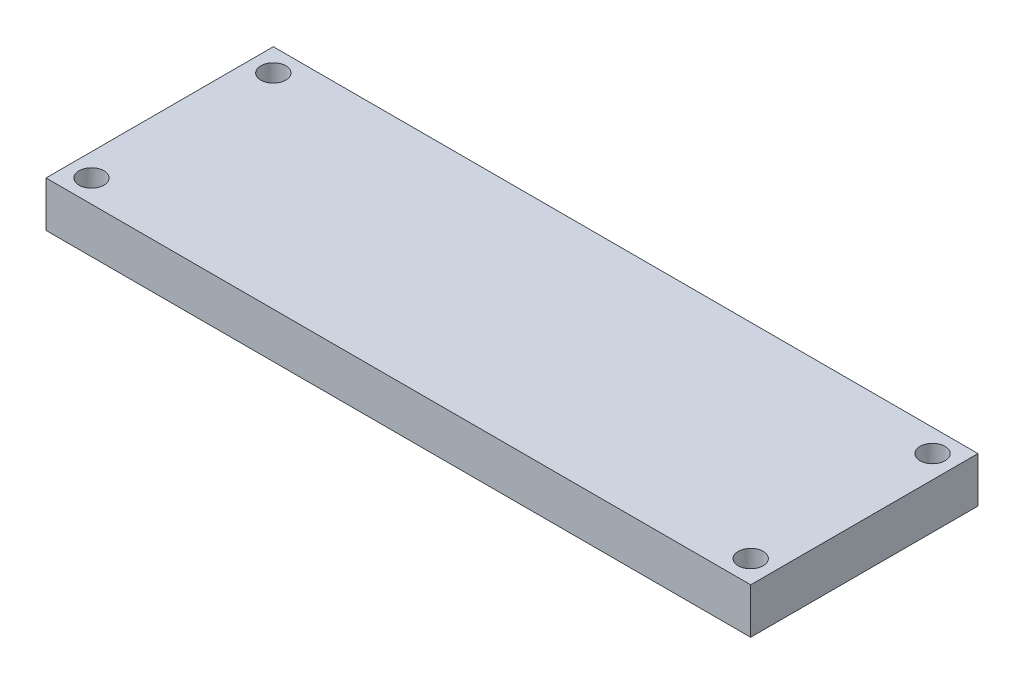
from build123d import *

# Parameters (mm, degrees)
SKETCH1_W           = 31
SKETCH1_H           = 10
SKETCH1_R           = 0.55
BOSS_EXTRUDE1_DEPTH = 2


with BuildPart() as part:
    # Sketch1 → Boss-Extrude1 (new body)
    with BuildSketch(Plane(origin=(0, 0, 0), x_dir=(1, 0, 0), z_dir=(0, 1, 0))):
        Rectangle(SKETCH1_W, SKETCH1_H)
        with Locations(Location((-14.5, 4, 0), (0, 0, 270))):
            Circle(SKETCH1_R, mode=Mode.SUBTRACT)
        with Locations(Location((14.5, 4, 0), (0, 0, 270))):
            Circle(SKETCH1_R, mode=Mode.SUBTRACT)
        with Locations(Location((14.5, -4, 0), (0, 0, 270))):
            Circle(SKETCH1_R, mode=Mode.SUBTRACT)
        with Locations(Location((-14.5, -4, 0), (0, 0, 270))):
            Circle(SKETCH1_R, mode=Mode.SUBTRACT)
    extrude(amount=BOSS_EXTRUDE1_DEPTH)


solid = part.part
